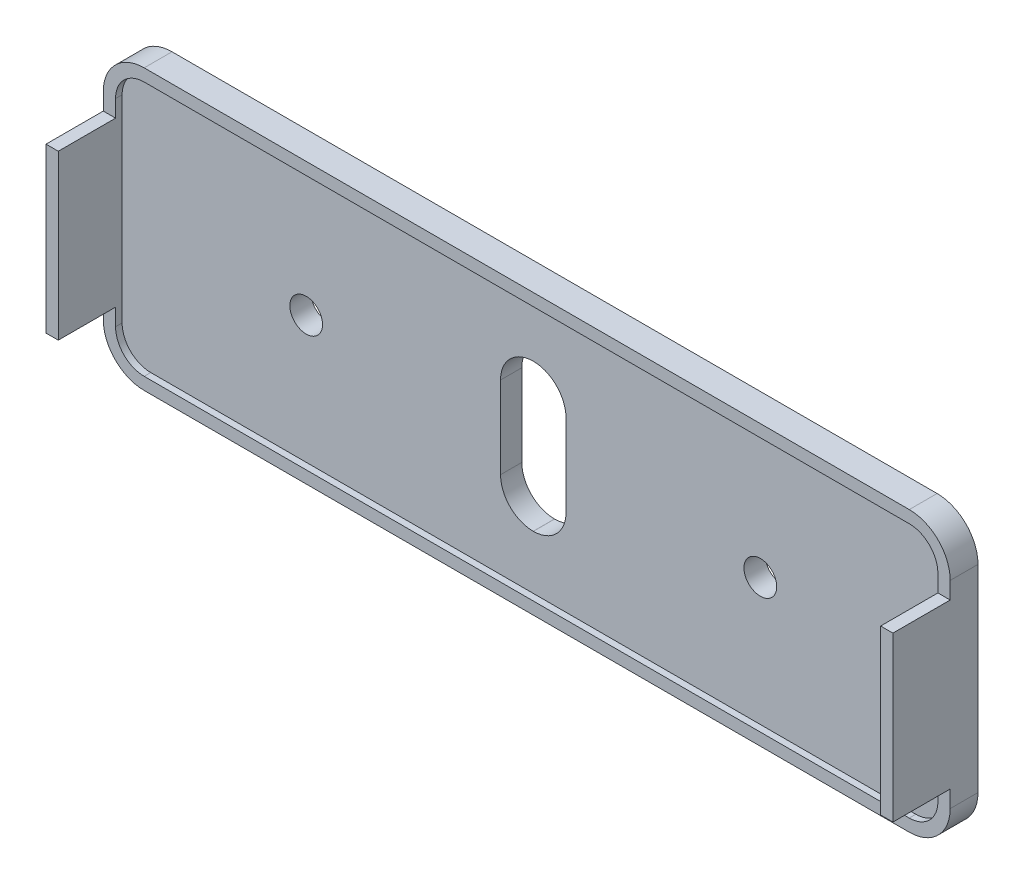
from build123d import *

# Parameters (mm, degrees)
SKETCH1_R           = 2
BOSS_EXTRUDE1_DEPTH = 3.4
CUT_EXTRUDE1_START  = -0.8
SKETCH2_R           = 2
CUT_EXTRUDE1_DEPTH  = 0.8
SKETCH3_W           = 1.5
SKETCH3_H           = 20
BOSS_EXTRUDE2_DEPTH = 7


with BuildPart() as part:
    # Sketch1 → Boss-Extrude1 (new body)
    with BuildSketch(Plane.XY):
        with BuildLine():
            Line((-46.75, 17.075), (46.75, 17.075))
            ThreePointArc((46.75, 17.075), (50.285533906, 15.610533906), (51.75, 12.075))
            Line((51.75, 12.075), (51.75, -12.075))
            ThreePointArc((51.75, -12.075), (50.285533906, -15.610533906), (46.75, -17.075))
            Line((46.75, -17.075), (-46.75, -17.075))
            ThreePointArc((-46.75, -17.075), (-50.285533906, -15.610533906), (-51.75, -12.075))
            Line((-51.75, -12.075), (-51.75, 12.075))
            ThreePointArc((-51.75, 12.075), (-50.285533906, 15.610533906), (-46.75, 17.075))
        make_face()
        with Locations((-27.75, 0)):
            Circle(SKETCH1_R, mode=Mode.SUBTRACT)
        with Locations((27.75, 0)):
            Circle(SKETCH1_R, mode=Mode.SUBTRACT)
        with BuildLine():
            Line((-0.01, 9), (0.01, 9))
            ThreePointArc((0.01, 9), (2.831356057, 7.831356057), (4, 5.01))
            Line((4, 5.01), (4, -5.01))
            ThreePointArc((4, -5.01), (2.831356057, -7.831356057), (0.01, -9))
            Line((0.01, -9), (-0.01, -9))
            ThreePointArc((-0.01, -9), (-2.831356057, -7.831356057), (-4, -5.01))
            Line((-4, -5.01), (-4, 5.01))
            ThreePointArc((-4, 5.01), (-2.831356057, 7.831356057), (-0.01, 9))
        make_face(mode=Mode.SUBTRACT)
    extrude(amount=BOSS_EXTRUDE1_DEPTH)

    # Sketch2 → Cut-Extrude1 (cut)
    with BuildSketch(Plane.XY.offset(3.4).offset(CUT_EXTRUDE1_START)):
        with BuildLine():
            Line((50.25, -12.075), (50.25, 12.075))
            ThreePointArc((50.25, 12.075), (49.224873734, 14.549873734), (46.75, 15.575))
            Line((46.75, 15.575), (-46.75, 15.575))
            ThreePointArc((-46.75, 15.575), (-49.224873734, 14.549873734), (-50.25, 12.075))
            Line((-50.25, 12.075), (-50.25, -12.075))
            ThreePointArc((-50.25, -12.075), (-49.224873734, -14.549873734), (-46.75, -15.575))
            Line((-46.75, -15.575), (46.75, -15.575))
            ThreePointArc((46.75, -15.575), (49.224873734, -14.549873734), (50.25, -12.075))
        make_face()
        with Locations((-27.75, 0)):
            Circle(SKETCH2_R, mode=Mode.SUBTRACT)
        with Locations((27.75, 0)):
            Circle(SKETCH2_R, mode=Mode.SUBTRACT)
        with BuildLine():
            ThreePointArc((0.01, 9), (2.831356057, 7.831356057), (4, 5.01))
            Line((4, 5.01), (4, -5.01))
            ThreePointArc((4, -5.01), (2.831356057, -7.831356057), (0.01, -9))
            Line((0.01, -9), (-0.01, -9))
            ThreePointArc((-0.01, -9), (-2.831356057, -7.831356057), (-4, -5.01))
            Line((-4, -5.01), (-4, 5.01))
            ThreePointArc((-4, 5.01), (-2.831356057, 7.831356057), (-0.01, 9))
            Line((-0.01, 9), (0.01, 9))
        make_face(mode=Mode.SUBTRACT)
    extrude(amount=CUT_EXTRUDE1_DEPTH, mode=Mode.SUBTRACT)

    # Sketch3 → Boss-Extrude2 (add)
    with BuildSketch(Plane.XY.offset(3.4)):
        with Locations((-51, 0)):
            Rectangle(SKETCH3_W, SKETCH3_H)
    boss_extrude2 = extrude(amount=BOSS_EXTRUDE2_DEPTH)

    # Mirror1: Boss-Extrude2 across plane
    add(boss_extrude2.mirror(Plane(origin=(0, 0, 0), x_dir=(0, 0, 1), z_dir=(1, 0, 0))))


solid = part.part
